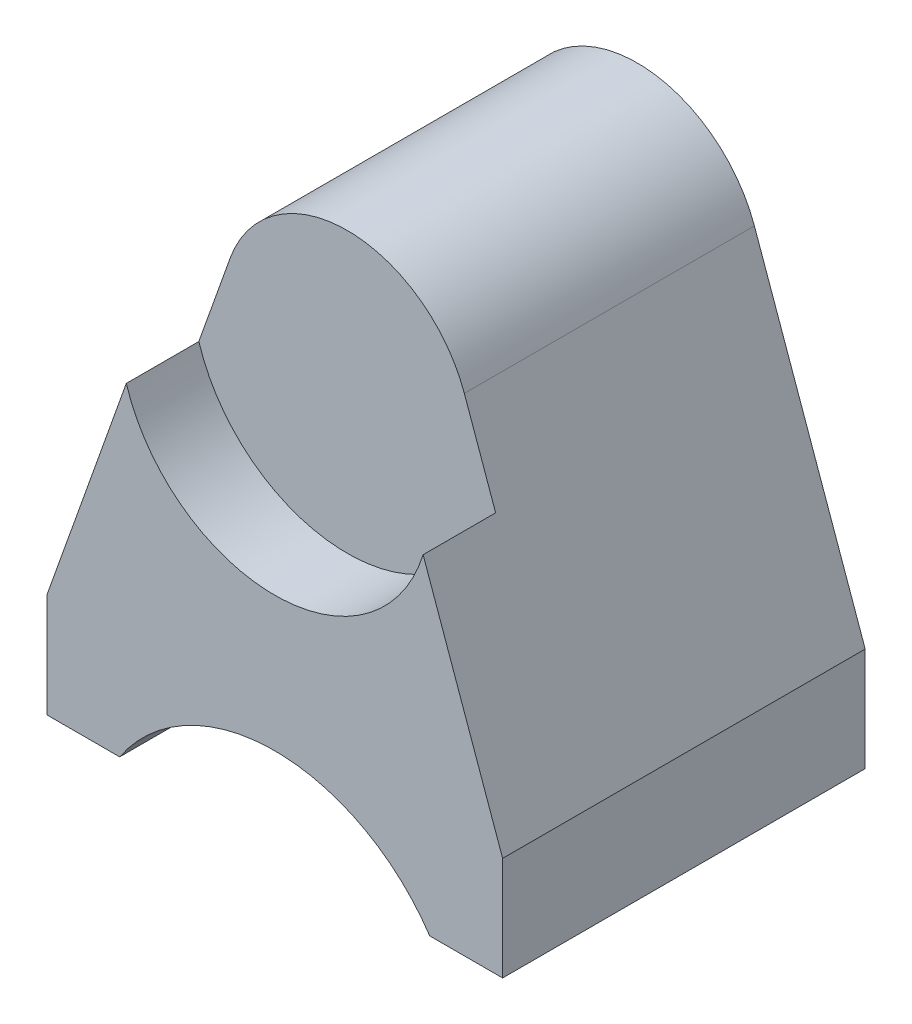
from build123d import *

# Parameters (mm, degrees)
BOSS_EXTRUDE1_DEPTH = 17.5
SKETCH2_R           = 15
CUT_EXTRUDE1_DEPTH  = 7


with BuildPart() as part:
    # Sketch1 → Boss-Extrude1 (new, symmetric)
    with BuildSketch(Plane.XY):
        with BuildLine():
            Line((14.966629547, 0), (22, 0))
            Line((22, 0), (22, 10))
            Line((22, 10), (11.304244422, 40.026668357))
            ThreePointArc((11.304244422, 40.026668357), (0, 48), (-11.304244422, 40.026668357))
            Line((-11.304244422, 40.026668357), (-22, 10))
            Line((-22, 10), (-22, 0))
            Line((-22, 0), (-14.966629547, 0))
            ThreePointArc((-14.966629547, 0), (0, 8), (14.966629547, 0))
        make_face()
    extrude(amount=BOSS_EXTRUDE1_DEPTH, both=True)

    # Sketch2 → Cut-Extrude1 (cut)
    with BuildSketch(Plane.XY.offset(17.5)):
        with Locations((0, 36)):
            Circle(SKETCH2_R)
    extrude(amount=-CUT_EXTRUDE1_DEPTH, mode=Mode.SUBTRACT)


solid = part.part
